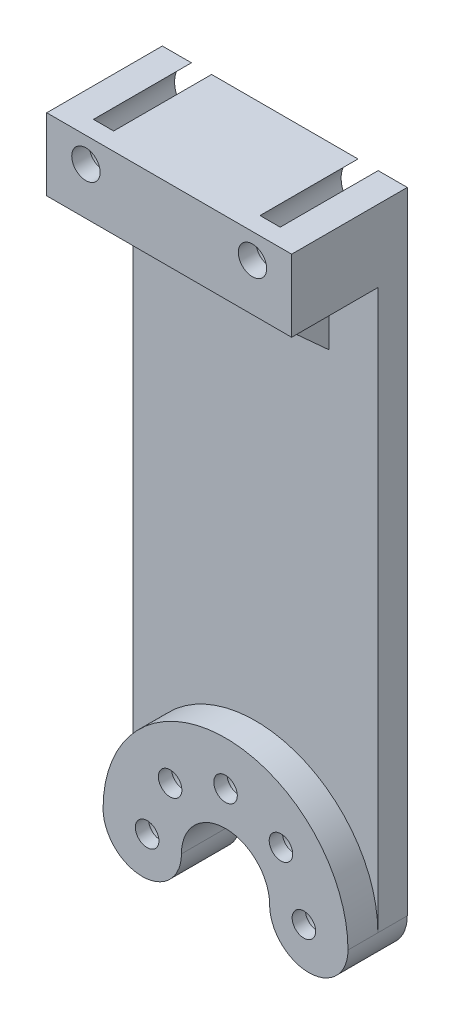
from build123d import *

# Parameters (mm, degrees)
RESSALTO_EXTRUS_O1_DEPTH            = 3.05
RESSALTO_EXTRUS_O2_DEPTH            = 3
ESBO_O4_W                           = 25
ESBO_O4_H                           = 7.35
RESSALTO_EXTRUS_O3_DEPTH            = 11.8
REBAIXO_PARA_SHCS_M2_51_D           = 2.9
REBAIXO_PARA_SHCS_M2_51_CBORE_D     = 5.5
REBAIXO_PARA_SHCS_M2_51_CBORE_DEPTH = 10
REBAIXO_PARA_SHCS_M21_D             = 2.4
REBAIXO_PARA_SHCS_M21_CBORE_D       = 4.4
REBAIXO_PARA_SHCS_M21_CBORE_DEPTH   = 4.7
NERVURA1_REACH                      = 67.869
ESBO_O5_WALL_W                      = 145.630512272
ESBO_O5_WALL_H                      = 15
CORTE_EXTRUS_O1_REACH               = 68.178
ESBO_O6_W                           = 8.93885445
ESBO_O6_H                           = 8


with BuildPart() as part:
    # Esboço1 → Ressalto-extrusão1 (new body)
    with BuildSketch(Plane.XY):
        with BuildLine():
            ThreePointArc((4.5, 0), (0, 4.5), (-4.5, 0))
            ThreePointArc((-4.5, 0), (-8.5, -4), (-12.5, 0))
            ThreePointArc((-12.5, 0), (0, 12.5), (12.5, 0))
            ThreePointArc((12.5, 0), (8.5, -4), (4.5, 0))
        make_face()
    extrude(amount=-RESSALTO_EXTRUS_O1_DEPTH)

    # Esboço2 → Ressalto-extrusão2 (add)
    with BuildSketch(Plane(origin=(0, 0, -3.05), x_dir=(-1, 0, 0), z_dir=(0, 0, -1))):
        with BuildLine():
            Line((-12.5, 64.388275999), (12.5, 64.388275999))
            Line((12.5, 64.388275999), (12.5, 0))
            ThreePointArc((12.5, 0), (8.5, -4), (4.5, 0))
            ThreePointArc((4.5, 0), (0, 4.5), (-4.5, 0))
            ThreePointArc((-4.5, 0), (-8.5, -4), (-12.5, 0))
            Line((-12.5, 0), (-12.5, 64.388275999))
        make_face()
    extrude(amount=RESSALTO_EXTRUS_O2_DEPTH)

    # Esboço4 → Ressalto-extrusão3 (add)
    with BuildSketch(Plane(origin=(0, 0, -6.05), x_dir=(-1, 0, 0), z_dir=(0, 0, -1))):
        with Locations((0, 60.713275999)):
            Rectangle(ESBO_O4_W, ESBO_O4_H)
    extrude(amount=-RESSALTO_EXTRUS_O3_DEPTH)

    # Rebaixo para SHCS M2.51 (through all)
    with Locations(Plane(origin=(0, 0, -6.05), x_dir=(-1, 0, 0), z_dir=(0, 0, -1))):
        with Locations((-8.5, 61.838275999), (8.5, 61.838275999)):
            CounterBoreHole(REBAIXO_PARA_SHCS_M2_51_D / 2, REBAIXO_PARA_SHCS_M2_51_CBORE_D / 2, REBAIXO_PARA_SHCS_M2_51_CBORE_DEPTH)

    # Rebaixo para SHCS M21 (through all)
    with Locations(Plane(origin=(0, 0, -6.05), x_dir=(-1, 0, 0), z_dir=(0, 0, -1))):
        with Locations((-8, 0), (-5.656854249, 5.656854249), (0, 8), (5.656854249, 5.656854249), (8, 0)):
            CounterBoreHole(REBAIXO_PARA_SHCS_M21_D / 2, REBAIXO_PARA_SHCS_M21_CBORE_D / 2, REBAIXO_PARA_SHCS_M21_CBORE_DEPTH)

    # Esboço5 wall → Nervura1 (add, up to next)
    with BuildSketch(Plane(origin=(0, 53.038275999, 1.35), x_dir=(0, -0.672672793996, -0.739940073396), z_dir=(0, 0.739940073396, -0.672672793996)), mode=Mode.PRIVATE) as nervura1_sk1:
        Rectangle(ESBO_O5_WALL_W, ESBO_O5_WALL_H)
    nervura1_tool1 = extrude(nervura1_sk1.sketch, amount=NERVURA1_REACH, mode=Mode.PRIVATE) - part.part
    add(nervura1_tool1.solids().sort_by_distance((0, 53.038275999, 1.35))[0])

    # Esboço6 → Corte-extrusão1 (cut, up to next)
    with BuildSketch(Plane.XY.offset(-3.05), mode=Mode.PRIVATE) as corte_extrus_o1_sk1:
        with Locations((-0.067802218, 53.038275999)):
            Rectangle(ESBO_O6_W, ESBO_O6_H)
    corte_extrus_o1_tool1 = extrude(corte_extrus_o1_sk1.sketch, amount=CORTE_EXTRUS_O1_REACH, mode=Mode.PRIVATE) & part.part
    add(corte_extrus_o1_tool1.solids().sort_by_distance((-0.067802, 53.038276, -3.05))[0], mode=Mode.SUBTRACT)


solid = part.part
